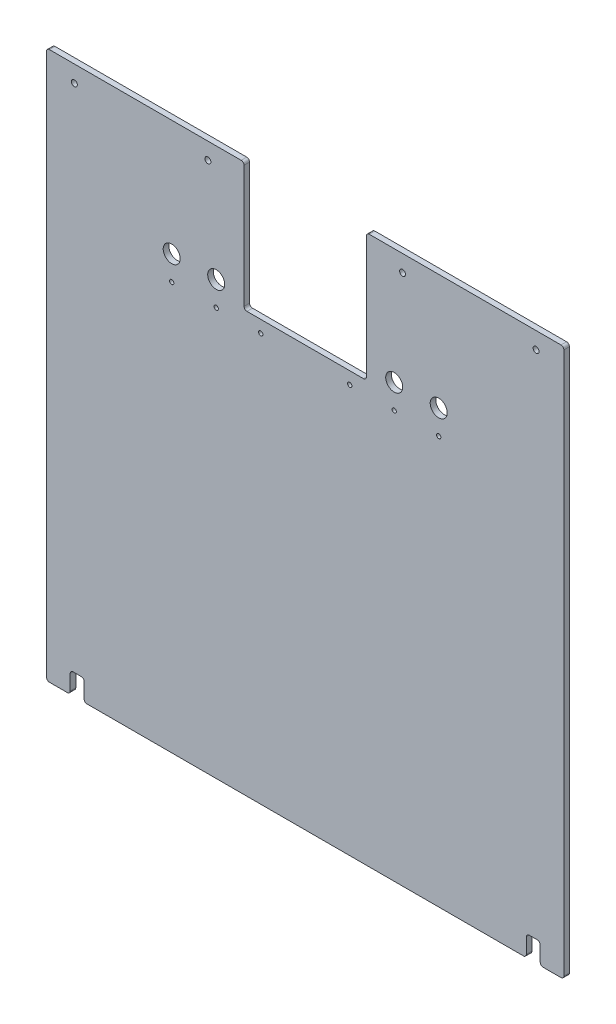
from build123d import *

# Parameters (mm, degrees)
SKETCH1_W                        = 590.55
SKETCH1_H                        = 479.425
BOSS_EXTRUDE1_DEPTH              = 6.35
SKETCH2_W                        = 15.875
SKETCH2_H                        = 23.8125
CUT_EXTRUDE1_DEPTH               = 761.682559038
F_10_0_1935_DIAMETER_HOLE1_D     = 4.9149
SKETCH6_W                        = 225.425
SKETCH6_H                        = 146.05
BOSS_EXTRUDE3_DEPTH              = 6.35
F_49_64_0_76563_DIAMETER_HOLE1_D = 19.447002
F_1_4_CLEARANCE_HOLE1_D          = 6.7564
FILLET1_R                        = 3.302


with BuildPart() as part:
    # Sketch1 → Boss-Extrude1 (new body)
    with BuildSketch(Plane.XY):
        with Locations((295.275, 239.7125)):
            Rectangle(SKETCH1_W, SKETCH1_H)
    extrude(amount=BOSS_EXTRUDE1_DEPTH)

    # Sketch2 → Cut-Extrude1 (cut, through all)
    with BuildSketch(Plane.XY.offset(6.35)):
        with Locations((34.925, 11.90625)):
            Rectangle(SKETCH2_W, SKETCH2_H)
        with Locations((555.625, 11.90625)):
            Rectangle(SKETCH2_W, SKETCH2_H)
    extrude(amount=-CUT_EXTRUDE1_DEPTH, mode=Mode.SUBTRACT)

    # #10 (0.1935) Diameter Hole1 (through all)
    with Locations(Plane.XY.offset(6.35)):
        with Locations((142.875, 465.507832), (244.475, 465.507832), (346.075, 465.507832), (447.675, 465.507832), (193.675, 465.507832), (396.875, 465.507832)):
            Hole(F_10_0_1935_DIAMETER_HOLE1_D / 2)

    # Sketch6 → Boss-Extrude3 (add)
    with BuildSketch(Plane.XY.offset(6.35)):
        with Locations((477.8375, 552.45)):
            Rectangle(SKETCH6_W, SKETCH6_H)
        with Locations((112.7125, 552.45)):
            Rectangle(SKETCH6_W, SKETCH6_H)
    extrude(amount=-BOSS_EXTRUDE3_DEPTH)

    # 49/64 (0.76563) Diameter Hole1 (through all)
    with Locations(Plane.XY.offset(6.35)):
        with Locations((142.875, 493.342168), (447.675, 493.342168), (193.675, 493.342168), (396.875, 493.342168)):
            Hole(F_49_64_0_76563_DIAMETER_HOLE1_D / 2)

    # 1/4 Clearance Hole1 (through all)
    with Locations(Plane.XY.offset(6.35)):
        with Locations((31.75, 606.425), (184.15, 606.425), (406.4, 606.425), (558.8, 606.425)):
            Hole(F_1_4_CLEARANCE_HOLE1_D / 2)

    # Fillet1
    fillet1_edges = [part.edges().sort_by_distance(p)[0] for p in [
        (42.8625, 0, 3.175),
        (26.9875, 0, 3.175),
        (26.9875, 23.8125, 3.175),
        (42.8625, 23.8125, 3.175),
        (563.5625, 0, 3.175),
        (547.6875, 0, 3.175),
        (547.6875, 23.8125, 3.175),
        (563.5625, 23.8125, 3.175),
        (590.55, 0, 3.175),
        (365.125, 625.475, 3.175),
        (365.125, 479.425, 3.175),
        (590.55, 625.475, 3.175),
        (0, 0, 3.175),
        (225.425, 479.425, 3.175),
        (225.425, 625.475, 3.175),
        (0, 625.475, 3.175),
    ]]
    fillet(fillet1_edges, radius=FILLET1_R)


solid = part.part
